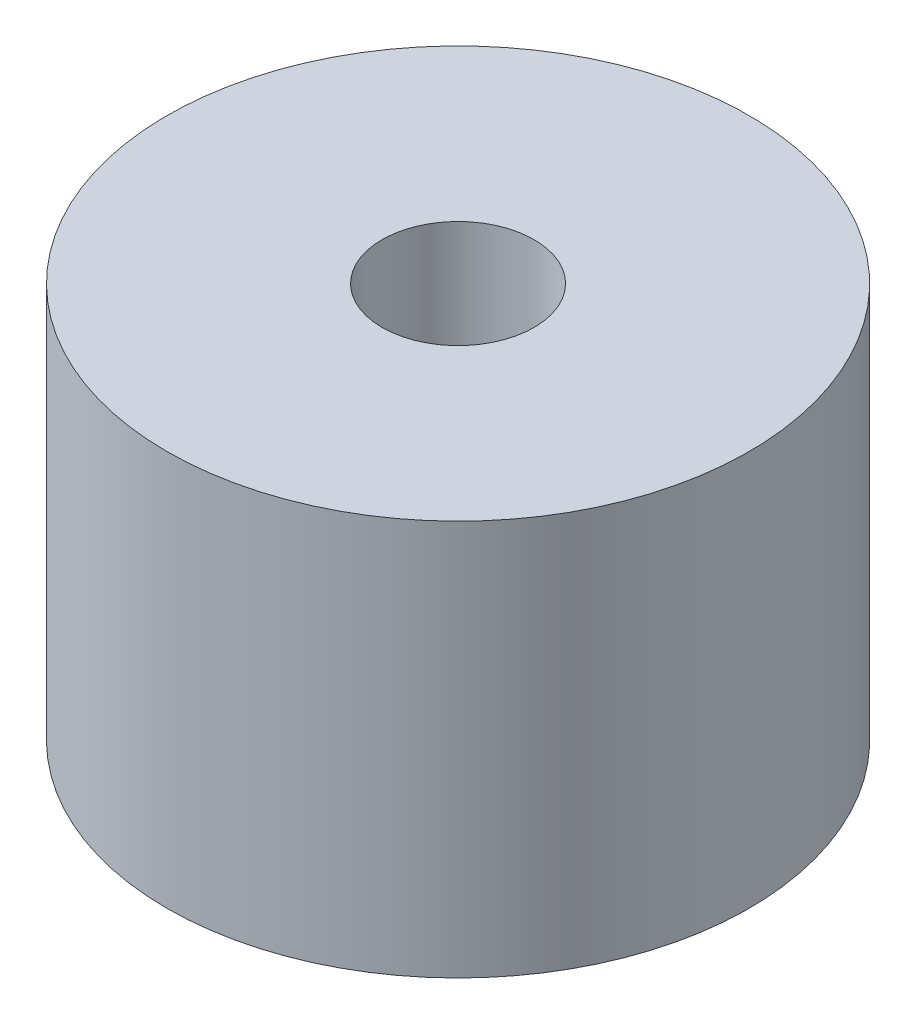
from build123d import *

# Parameters (mm, degrees)
SKETCH1_R              = 9.525
BOSS_EXTRUDE1_DEPTH    = 12.94765
F_10_CLEARANCE_HOLE1_D = 4.9784


with BuildPart() as part:
    # Sketch1 → Boss-Extrude1 (new body)
    with BuildSketch(Plane(origin=(0, 0, 0), x_dir=(1, 0, 0), z_dir=(0, 1, 0))):
        with Locations(Location((0, 0, 0), (0, 0, 270))):
            Circle(SKETCH1_R)
    extrude(amount=BOSS_EXTRUDE1_DEPTH)

    # #10 Clearance Hole1 (through all)
    with Locations(Plane(origin=(0, 12.94765, 0), x_dir=(1, 0, 0), z_dir=(0, 1, 0))):
        with Locations((0, 0)):
            Hole(F_10_CLEARANCE_HOLE1_D / 2)


solid = part.part
